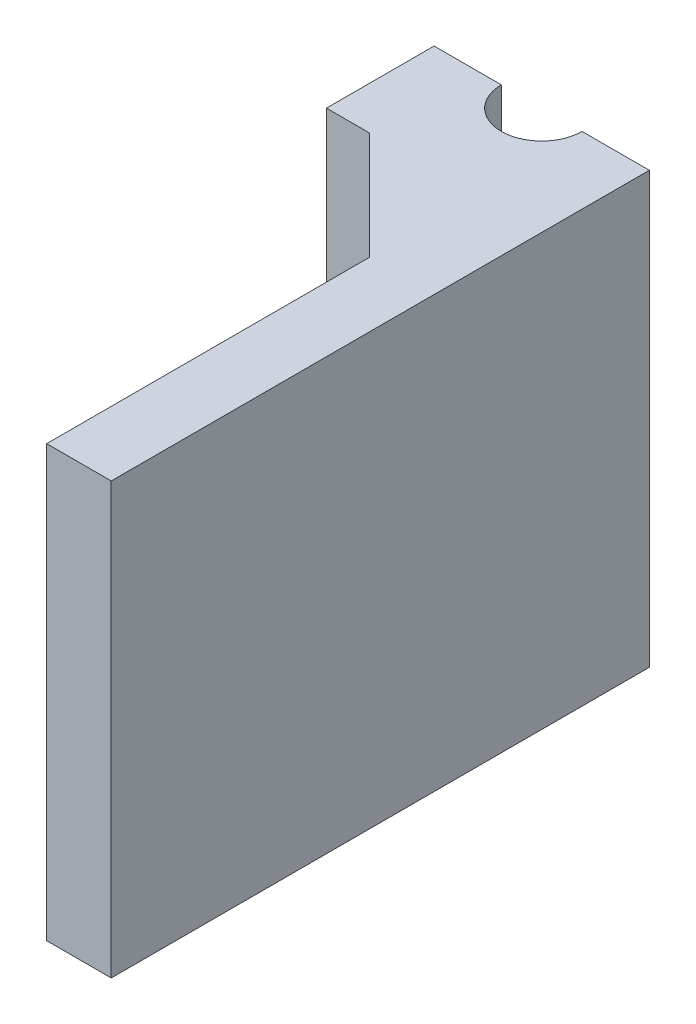
from build123d import *

# Parameters (mm, degrees)
BOSS_EXTRUDE1_DEPTH     = 10
CUT_EXTRUDE2_DEPTH      = 4.88
CUT_EXTRUDE4_DEPTH      = 18.67766953
CUT_EXTRUDE4_DEPTH_BACK = 18.67766953
SKETCH6_3_R             = 1.875
CUT_EXTRUDE5_DEPTH      = 24.58495283
CUT_EXTRUDE5_DEPTH_BACK = 24.58495283
SKETCH7_OUTSIDE_W       = 17.386
SKETCH7_OUTSIDE_H       = 22.386
SKETCH8_W               = 3
SKETCH8_H               = 20
BOSS_EXTRUDE2_DEPTH     = 20
CHAMFER1_SIZE           = 5


with BuildPart() as part:
    # Sketch2 → Boss-Extrude1 (new body)
    with BuildSketch(Plane.YZ):
        Polygon((-10, -7.5), (-4, -7.5), (-5, -5.5), (-2.5, -5.5), (-2.5, -3), (2.5, -3), (2.5, -5.5), (5, -5.5), (4, -7.5), (10, -7.5), (10, 7.5), (-10, 7.5), align=None)
    extrude(amount=BOSS_EXTRUDE1_DEPTH)

    # Sketch4 → Cut-Extrude2 (cut)
    with BuildSketch(Plane(origin=(0, 0, -3), x_dir=(1, 0, 0), z_dir=(0, 0, -1))):
        Polygon((5, 2.5), (2, 2.5), (2, -2.5), (8, -2.5), (8, 2.5), align=None)
    extrude(amount=-CUT_EXTRUDE2_DEPTH, mode=Mode.SUBTRACT)

    # Sketch6<3> → Cut-Extrude4 (cut, two sides: drawn at the far end of the back side and taken through both)
    with BuildSketch(Plane.XZ.offset(-2.5).offset(-CUT_EXTRUDE4_DEPTH_BACK)):
        with Locations((5, -1.12)):
            Circle(SKETCH6_3_R)
    extrude(amount=CUT_EXTRUDE4_DEPTH + CUT_EXTRUDE4_DEPTH_BACK, mode=Mode.SUBTRACT)

    # Sketch7 outside → Cut-Extrude5 (cut, two sides: drawn at the far end of the back side and taken through both)
    with BuildSketch(Plane(origin=(0, 10, 0), x_dir=(-1, 0, 0), z_dir=(0, 1, 0)).offset(-CUT_EXTRUDE5_DEPTH_BACK)):
        with Locations((-5, 0)):
            Rectangle(SKETCH7_OUTSIDE_W, SKETCH7_OUTSIDE_H)
        with BuildLine():
            Line((-10, -1.12), (-6.875, -1.12))
            ThreePointArc((-6.875, -1.12), (-5, 0.755), (-3.125, -1.12))
            Line((-3.125, -1.12), (0, -1.12))
            Line((0, -1.12), (0, 3.88))
            Line((0, 3.88), (-10, 3.88))
            Line((-10, 3.88), (-10, -1.12))
        make_face(mode=Mode.SUBTRACT)
    extrude(amount=CUT_EXTRUDE5_DEPTH + CUT_EXTRUDE5_DEPTH_BACK, mode=Mode.SUBTRACT)

    # Sketch8 → Boss-Extrude2 (add)
    with BuildSketch(Plane.XY.offset(3.88)):
        with Locations((8.5, 0)):
            Rectangle(SKETCH8_W, SKETCH8_H)
    extrude(amount=BOSS_EXTRUDE2_DEPTH)

    # Chamfer1
    chamfer1_edges = [part.edges().sort_by_distance(p)[0] for p in [
        (7, 0, 3.88),
    ]]
    chamfer(chamfer1_edges, length=CHAMFER1_SIZE)


solid = part.part
